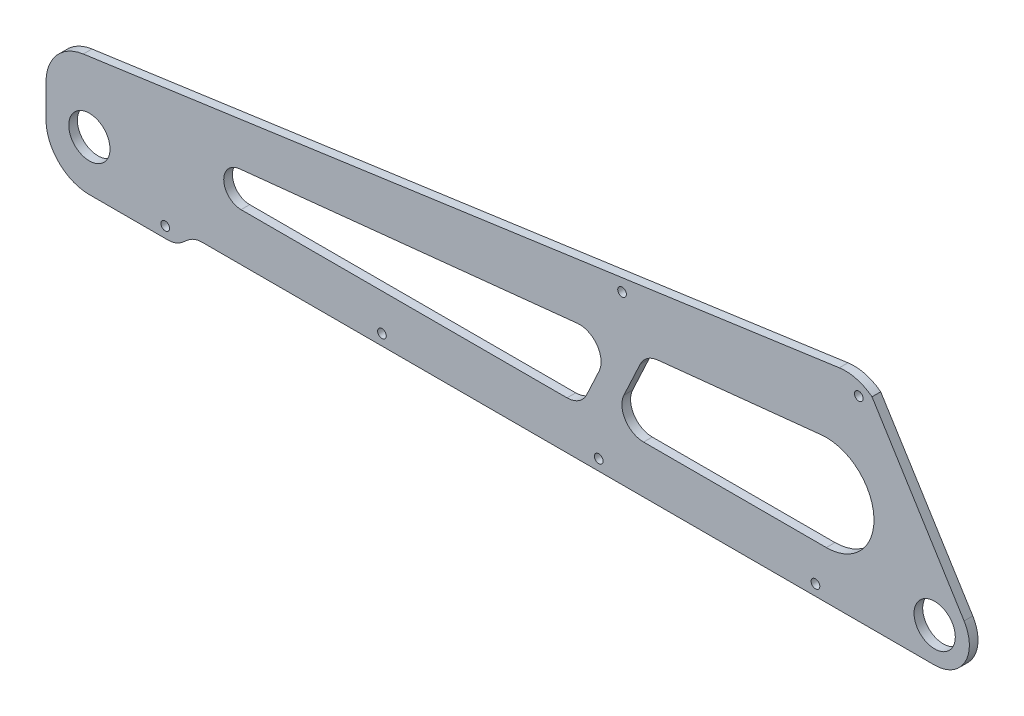
from build123d import *

# Parameters (mm, degrees)
SKETCH_1_R      = 2
SKETCH_1_R_2    = 9.52
EXTRUDE_1_DEPTH = 4


with BuildPart() as part:
    # 草图1 → 凸台-拉伸1 (new body)
    with BuildSketch(Plane.XY):
        with BuildLine():
            Line((-217.492033448, 3.233624406), (131.287449442, 52.251384058))
            ThreePointArc((131.287449442, 52.251384058), (139.247292364, 51.764539209), (146.384140968, 48.206237756))
            Line((146.384140968, 48.206237756), (188.878227524, -20.121950331))
            ThreePointArc((188.878227524, -20.121950331), (189.277074538, -36.343590473), (175.291428571, -44.571736969))
            Line((175.291428571, -44.571736969), (-162.726593938, -44.571736969))
            ThreePointArc((-162.726593938, -44.571736969), (-166.146795371, -45.174810761), (-169.154470035, -46.911292538))
            Line((-169.154470035, -46.911292538), (-171.920397674, -49.2321814))
            ThreePointArc((-171.920397674, -49.2321814), (-174.928072338, -50.968663177), (-178.348273771, -51.571736969))
            Line((-178.348273771, -51.571736969), (-214.708571429, -51.571736969))
            ThreePointArc((-214.708571429, -51.571736969), (-228.850707052, -45.713872593), (-234.708571429, -31.571736969))
            Line((-234.708571429, -31.571736969), (-234.708571429, -16.571736969))
            ThreePointArc((-234.708571429, -16.571736969), (-229.802763033, -3.450556389), (-217.492033448, 3.233624406))
        make_face()
        with Locations((120.291428571, -39.571736969)):
            Circle(SKETCH_1_R, mode=Mode.SUBTRACT)
        with Locations((31.062311574, 32.428263031)):
            Circle(SKETCH_1_R, mode=Mode.SUBTRACT)
        with Locations((175.291428571, -28.571736969)):
            Circle(SKETCH_1_R_2, mode=Mode.SUBTRACT)
        with Locations((-79.708571429, -39.571736969)):
            Circle(SKETCH_1_R, mode=Mode.SUBTRACT)
        with Locations((-214.708571429, -28.571736969)):
            Circle(SKETCH_1_R_2, mode=Mode.SUBTRACT)
        with Locations((140.291428571, 45.428263031)):
            Circle(SKETCH_1_R, mode=Mode.SUBTRACT)
        with Locations((-179.708571429, -46.571736969)):
            Circle(SKETCH_1_R, mode=Mode.SUBTRACT)
        with Locations((20.291428571, -39.571736969)):
            Circle(SKETCH_1_R, mode=Mode.SUBTRACT)
        with BuildLine():
            Line((40.988284343, -22.571736969), (125.291428571, -22.571736969))
            ThreePointArc((125.291428571, -22.571736969), (147.261913315, 0.567473351), (123.016064666, 21.310281199))
            Line((123.016064666, 21.310281199), (47.451409263, 13.452820882))
            ThreePointArc((47.451409263, 13.452820882), (42.683150544, 11.650822458), (39.422587713, 7.732631605))
            Line((39.422587713, 7.732631605), (31.925206472, -8.345554352))
            ThreePointArc((31.925206472, -8.345554352), (32.554369884, -17.944733053), (40.988284343, -22.571736969))
        make_face(mode=Mode.SUBTRACT)
        with BuildLine():
            Line((-144.708571429, -22.571736969), (5.680190936, -22.571736969))
            ThreePointArc((5.680190936, -22.571736969), (11.053187019, -21.005651427), (14.743268806, -16.797919586))
            Line((14.743268806, -16.797919586), (20.441380932, -4.578278698))
            ThreePointArc((20.441380932, -4.578278698), (19.522676532, 5.450418959), (10.344046742, 9.594275814))
            Line((10.344046742, 9.594275814), (-145.535976485, -6.614639453))
            ThreePointArc((-145.535976485, -6.614639453), (-152.697838608, -14.985995267), (-144.708571429, -22.571736969))
        make_face(mode=Mode.SUBTRACT)
    extrude(amount=EXTRUDE_1_DEPTH)


solid = part.part
